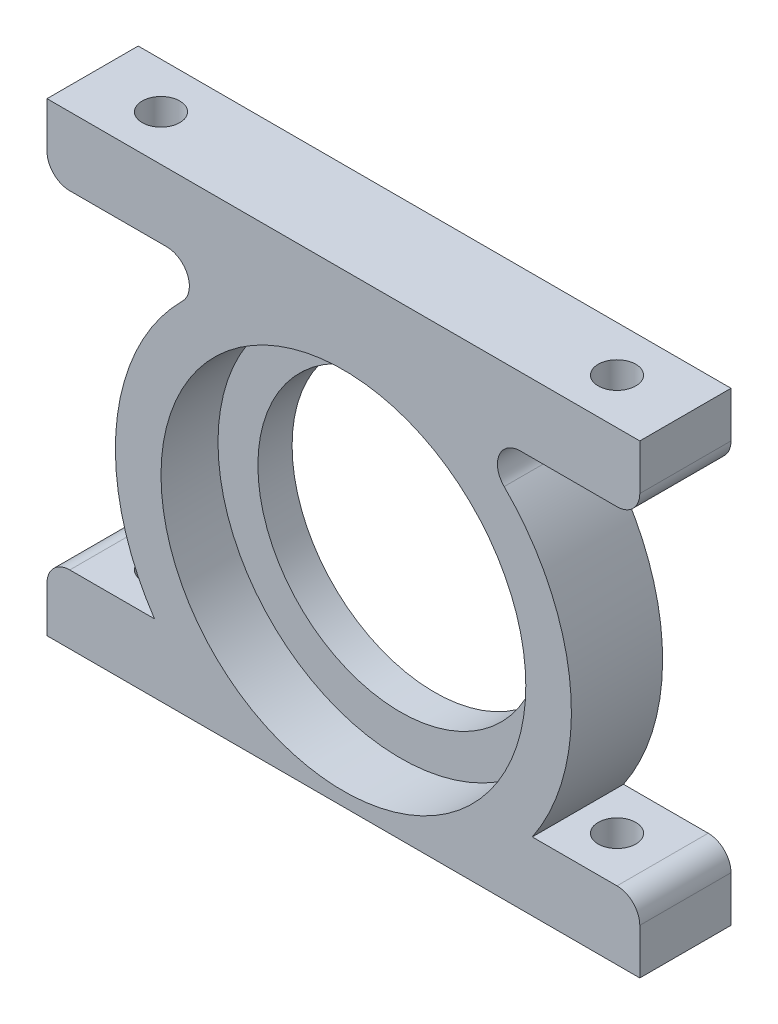
from build123d import *

# Parameters (mm, degrees)
SKETCH_1_R             = 16
EXTRUDE_1_DEPTH        = 8
FILLET_1_R             = 2
SKETCH_4_R             = 16
SKETCH_4_R_2           = 12.5
EXTRUDE_2_DEPTH        = 3
HOLE_WIZARD_M4_3_D     = 3.3
HOLE_WIZARD_M4_3_DEPTH = 6
HOLE_WIZARD_M4_4_D     = 3.3
HOLE_WIZARD_M4_4_DEPTH = 6


with BuildPart() as part:
    # 草图1 → 凸台-拉伸1 (new body)
    with BuildSketch(Plane.XY):
        with BuildLine():
            Line((-26, 23.6), (26, 23.6))
            Line((26, 23.6), (26, 17.6))
            Line((26, 17.6), (9.49947367, 17.6))
            ThreePointArc((9.49947367, 17.6), (19.423244762, 4.76839207), (16.569852142, -11.2))
            Line((16.569852142, -11.2), (26, -11.2))
            Line((26, -11.2), (26, -17.2))
            Line((26, -17.2), (-26, -17.2))
            Line((-26, -17.2), (-26, -11.2))
            Line((-26, -11.2), (-16.569852142, -11.2))
            ThreePointArc((-16.569852142, -11.2), (-19.423244762, 4.76839207), (-9.49947367, 17.6))
            Line((-9.49947367, 17.6), (-26, 17.6))
            Line((-26, 17.6), (-26, 23.6))
        make_face()
        Circle(SKETCH_1_R, mode=Mode.SUBTRACT)
    extrude(amount=EXTRUDE_1_DEPTH)

    # 圆角1
    fillet_1_edges = [part.edges().sort_by_distance(p)[0] for p in [
        (-26, -11.2, 4),
        (-9.49947367, 17.6, 4),
        (-26, 17.6, 4),
        (26, 17.6, 4),
        (9.49947367, 17.6, 4),
        (26, -11.2, 4),
    ]]
    fillet(fillet_1_edges, radius=FILLET_1_R)

    # 草图4 → 凸台-拉伸2 (add)
    with BuildSketch(Plane(origin=(0, 0, 0), x_dir=(-1, 0, 0), z_dir=(0, 0, -1))):
        Circle(SKETCH_4_R)
        Circle(SKETCH_4_R_2, mode=Mode.SUBTRACT)
    extrude(amount=-EXTRUDE_2_DEPTH)

    # M4 螺纹孔3
    with Locations(Plane(origin=(0, 23.6, 0), x_dir=(1, 0, 0), z_dir=(0, 1, 0))):
        with Locations((20, -4), (-20, -4)):
            Hole(HOLE_WIZARD_M4_3_D / 2, depth=HOLE_WIZARD_M4_3_DEPTH)

    # M4 螺纹孔4
    with Locations(Plane.XZ.offset(17.2)):
        with Locations((20, 4), (-20, 4)):
            Hole(HOLE_WIZARD_M4_4_D / 2, depth=HOLE_WIZARD_M4_4_DEPTH)


solid = part.part
